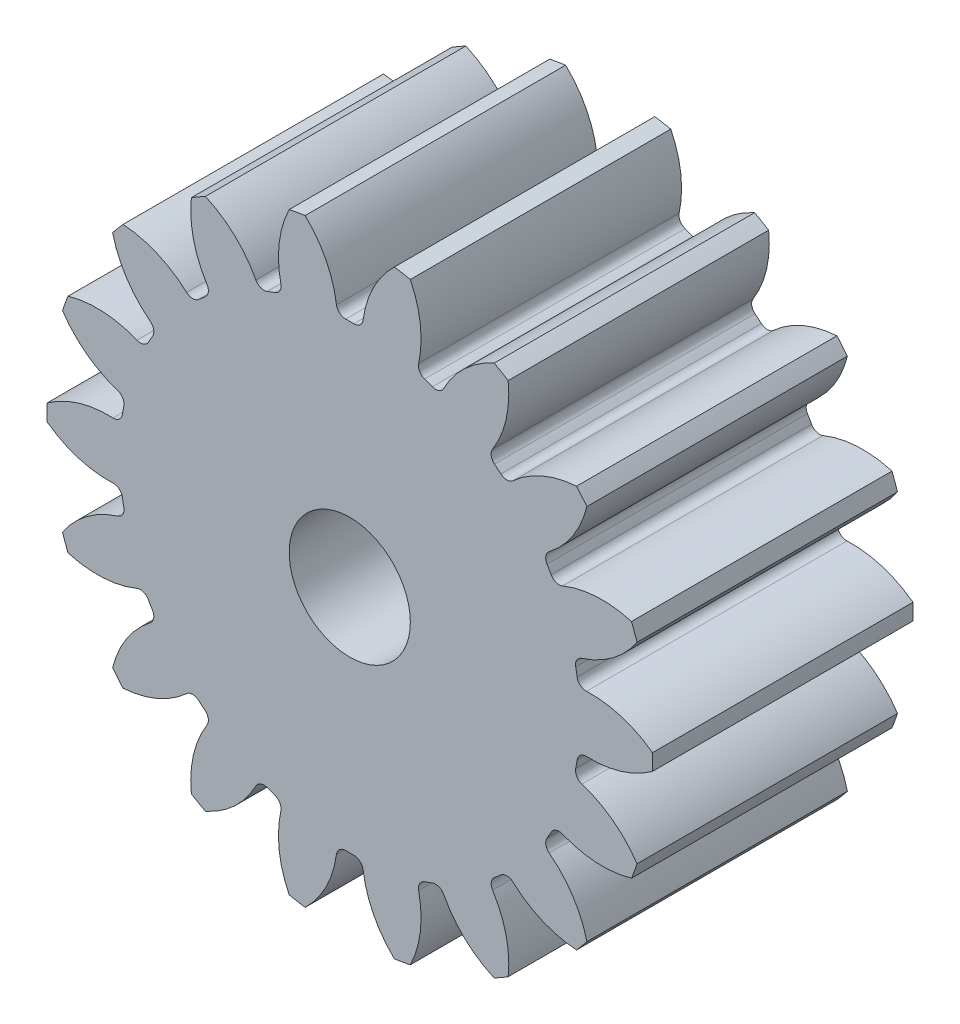
from build123d import *

# Parameters (mm, degrees)
SKETCH1_R                = 5
BOSS_EXTRUDE1_DEPTH      = 2.15
CUT_EXTRUDE1_DEPTH       = 8.39070362
FILLET1_R                = 0.15
CIRPATTERN1_COUNT        = 18
FILLET1_OF_CIRPATTERN1_R = 0.15
CUT_EXTRUDE2_DEPTH       = 8.353950974
CUT_EXTRUDE2_DEPTH_BACK  = 8.353950974
SKETCH2_R                = 1


with BuildPart() as part:
    # Sketch1 → Boss-Extrude1 (new, symmetric)
    with BuildSketch(Plane.XY):
        Circle(SKETCH1_R)
    extrude(amount=BOSS_EXTRUDE1_DEPTH, both=True)

    # Gear Profile → Cut-Extrude1 (cut, symmetric)
    with BuildSketch(Plane.XY):
        with BuildLine():
            ThreePointArc((-1.362608405, 5.328536228), (-0.551207912, 4.737388407), (-0.206930556, 3.794361573))
            ThreePointArc((-0.206930556, 3.794361573), (0, 3.8), (0.206930556, 3.794361573))
            ThreePointArc((0.206930556, 3.794361573), (0.551207912, 4.737388407), (1.362608405, 5.328536228))
            ThreePointArc((1.362608405, 5.328536228), (0, 5.5), (-1.362608405, 5.328536228))
        make_face()
    cut_extrude1 = extrude(amount=CUT_EXTRUDE1_DEPTH, both=True, mode=Mode.SUBTRACT)

    # Fillet1
    fillet1_edges = [part.edges().sort_by_distance(p)[0] for p in [
        (0.206930556, 3.794361573, 0),
        (-0.206930556, 3.794361573, 0),
    ]]
    fillet(fillet1_edges, radius=FILLET1_R)

    # CirPattern1: Cut-Extrude1 ×18 about axis
    cirpattern1_axis = Axis((0, 0, -2.75), (0, 0, 1))
    for i in range(1, CIRPATTERN1_COUNT):
        add(cut_extrude1.rotate(cirpattern1_axis, i * 360 / CIRPATTERN1_COUNT), mode=Mode.SUBTRACT)

    # Fillet1 of CirPattern1
    fillet1_of_cirpattern1_edges = [part.edges().sort_by_distance(p)[0] for p in [
        (-1.103296972, 3.636307989, 0),
        (-1.492199206, 3.494759152, 0),
        (-2.280450603, 3.039661996, 0),
        (-2.597486609, 2.7736372, 0),
        (-3.182548235, 2.076387905, 0),
        (-3.389478791, 1.717973668, 0),
        (-3.700783581, 0.862670789, 0),
        (-3.772649809, 0.455097156, 0),
        (-3.772649809, -0.455097156, 0),
        (-3.700783581, -0.862670789, 0),
        (-3.389478791, -1.717973668, 0),
        (-3.182548235, -2.076387905, 0),
        (-2.597486609, -2.7736372, 0),
        (-2.280450603, -3.039661996, 0),
        (-1.492199206, -3.494759152, 0),
        (-1.103296972, -3.636307989, 0),
        (-0.206930556, -3.794361573, 0),
        (0.206930556, -3.794361573, 0),
        (1.103296972, -3.636307989, 0),
        (1.492199206, -3.494759152, 0),
        (2.280450603, -3.039661996, 0),
        (2.597486609, -2.7736372, 0),
        (3.182548235, -2.076387905, 0),
        (3.389478791, -1.717973668, 0),
        (3.700783581, -0.862670789, 0),
        (3.772649809, -0.455097156, 0),
        (3.772649809, 0.455097156, 0),
        (3.700783581, 0.862670789, 0),
        (3.389478791, 1.717973668, 0),
        (3.182548235, 2.076387905, 0),
        (2.597486609, 2.7736372, 0),
        (2.280450603, 3.039661996, 0),
        (1.492199206, 3.494759152, 0),
        (1.103296972, 3.636307989, 0),
    ]]
    fillet(fillet1_of_cirpattern1_edges, radius=FILLET1_OF_CIRPATTERN1_R)

    # Sketch2 → Cut-Extrude2 (cut, two sides: drawn at the far end of the back side and taken through both)
    with BuildSketch(Plane.XY.offset(-CUT_EXTRUDE2_DEPTH_BACK)):
        Circle(SKETCH2_R)
    extrude(amount=CUT_EXTRUDE2_DEPTH + CUT_EXTRUDE2_DEPTH_BACK, mode=Mode.SUBTRACT)


solid = part.part
